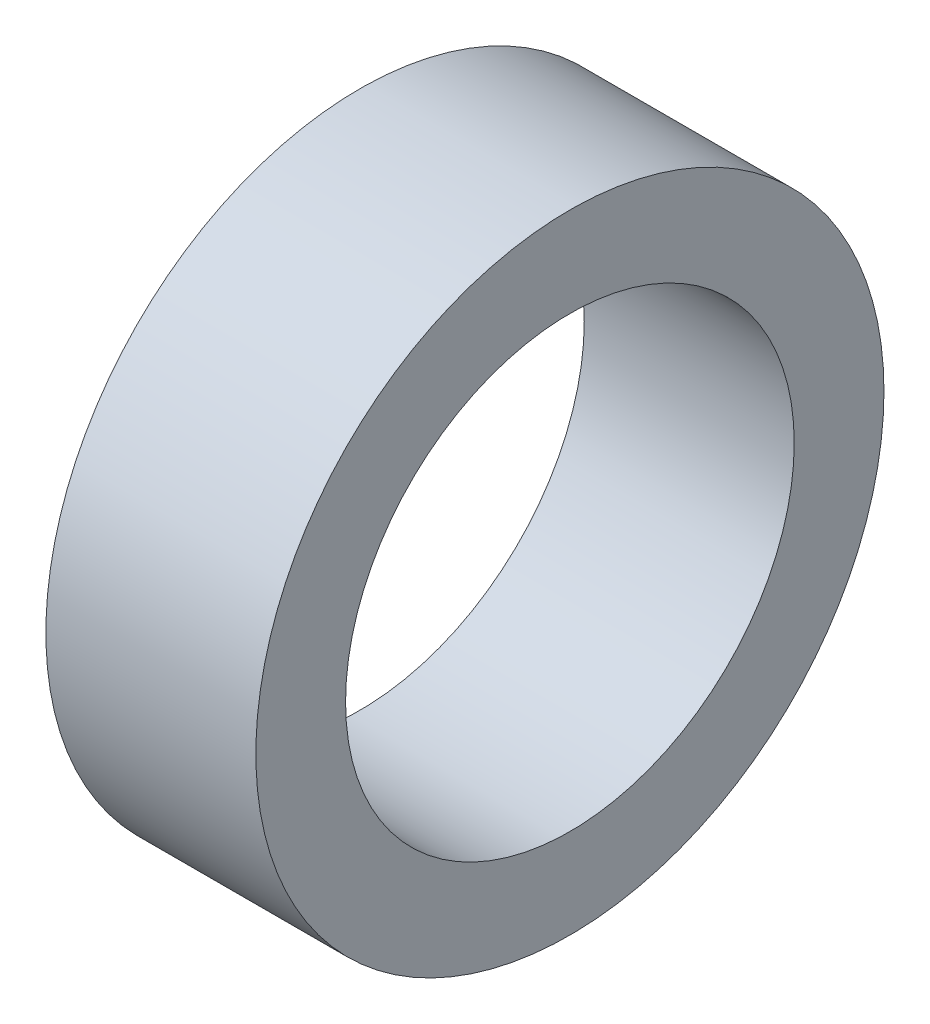
from build123d import *

# Parameters (mm, degrees)
SKETCH1_R           = 4.445
SKETCH1_R_2         = 3.175
BOSS_EXTRUDE1_DEPTH = 2.9718


with BuildPart() as part:
    # Sketch1 → Boss-Extrude1 (new body)
    with BuildSketch(Plane.YZ):
        with Locations(Location((0, 0, 0), (0, 0, 270))):
            Circle(SKETCH1_R)
        with Locations(Location((0, 0, 0), (0, 0, 270))):
            Circle(SKETCH1_R_2, mode=Mode.SUBTRACT)
    extrude(amount=BOSS_EXTRUDE1_DEPTH)


solid = part.part
